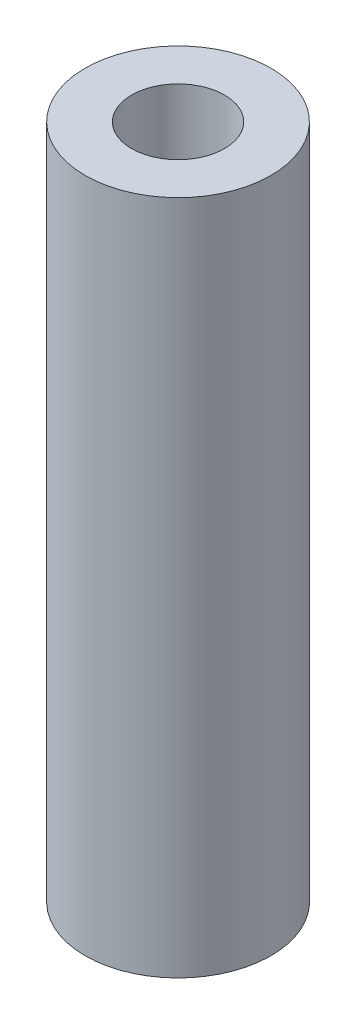
from build123d import *

# Parameters (mm, degrees)
SKETCH1_R           = 11
SKETCH1_R_2         = 5.5
BOSS_EXTRUDE1_DEPTH = 80


with BuildPart() as part:
    # Sketch1 → Boss-Extrude1 (new body)
    with BuildSketch(Plane(origin=(0, 0, 0), x_dir=(1, 0, 0), z_dir=(0, 1, 0))):
        with Locations(Location((0, 0, 0), (0, 0, 270))):
            Circle(SKETCH1_R)
        with Locations(Location((0, 0, 0), (0, 0, 270))):
            Circle(SKETCH1_R_2, mode=Mode.SUBTRACT)
    extrude(amount=BOSS_EXTRUDE1_DEPTH)


solid = part.part
